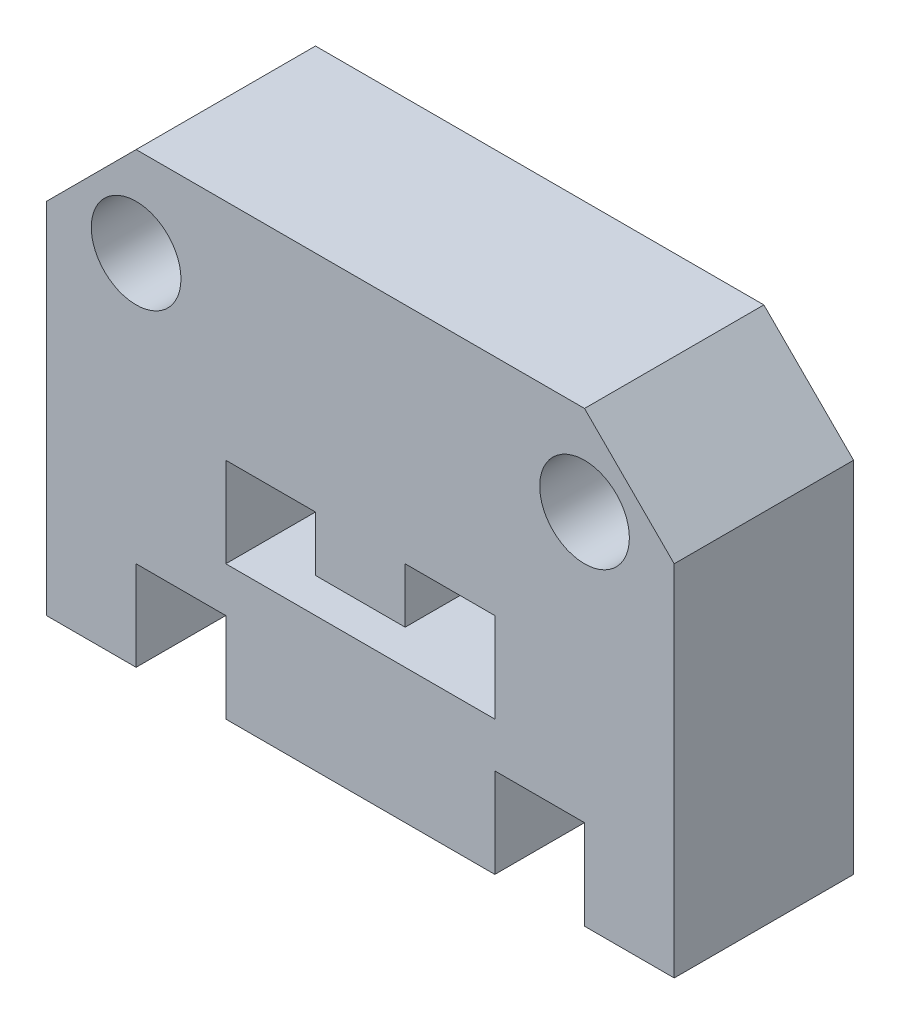
from build123d import *

# Parameters (mm, degrees)
SKETCH1_R           = 5
BOSS_EXTRUDE1_DEPTH = 20


with BuildPart() as part:
    # Sketch1 → Boss-Extrude1 (new body)
    with BuildSketch(Plane.XY):
        Polygon((-15, -18.874385216), (15, -18.874385216), (15, -8.874385216), (25, -8.874385216), (25, -18.874385216), (35, -18.874385216), (35, 21.125614784), (25, 31.125614784), (-25, 31.125614784), (-35, 21.125614784), (-35, -18.874385216), (-25, -18.874385216), (-25, -8.874385216), (-15, -8.874385216), align=None)
        with Locations((-25, 21.125614784)):
            Circle(SKETCH1_R, mode=Mode.SUBTRACT)
        with Locations((25, 21.125614784)):
            Circle(SKETCH1_R, mode=Mode.SUBTRACT)
        Polygon((-5, 0), (5, 0), (5, 6.125614784), (15, 6.125614784), (15, -3.874385216), (-15, -3.874385216), (-15, 6.125614784), (-5, 6.125614784), align=None, mode=Mode.SUBTRACT)
    extrude(amount=BOSS_EXTRUDE1_DEPTH)


solid = part.part
